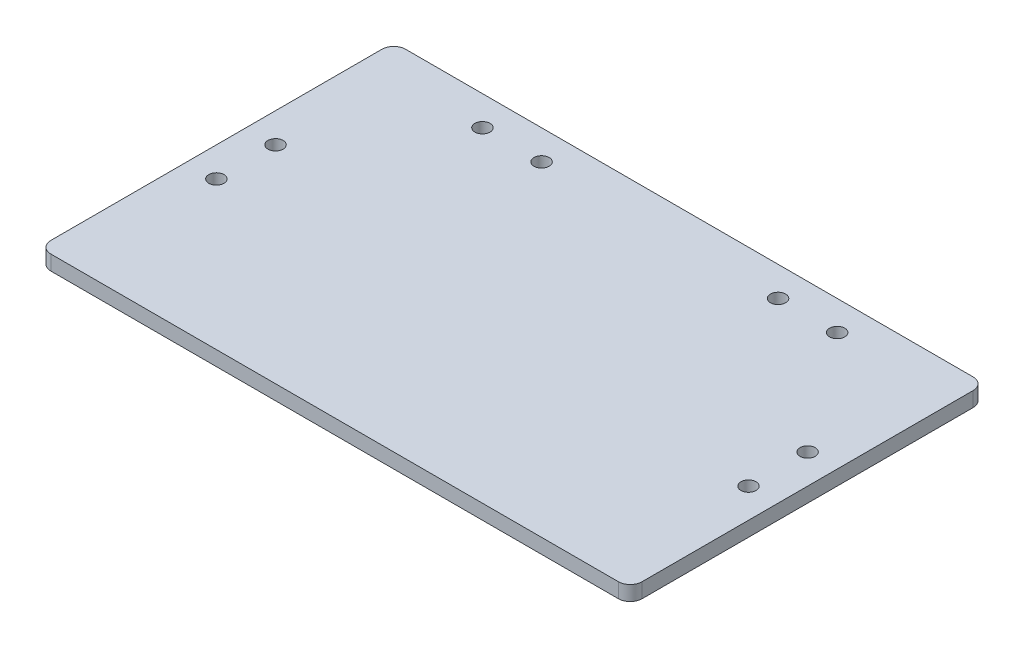
from build123d import *

# Parameters (mm, degrees)
SKETCH1_W           = 254
SKETCH1_H           = 152.4
BOSS_EXTRUDE1_DEPTH = 6.35
SKETCH3_R           = 3.2639
CUT_EXTRUDE2_DEPTH  = 149.24224263
FILLET1_R           = 5.08


with BuildPart() as part:
    # Sketch1 → Boss-Extrude1 (new body)
    with BuildSketch(Plane(origin=(0, 0, 0), x_dir=(1, 0, 0), z_dir=(0, 1, 0))):
        Rectangle(SKETCH1_W, SKETCH1_H)
    extrude(amount=BOSS_EXTRUDE1_DEPTH)

    # Sketch3 → Cut-Extrude2 (cut, through all)
    with BuildSketch(Plane(origin=(0, 6.35, 0), x_dir=(1, 0, 0), z_dir=(0, 1, 0))):
        with Locations(Location((-114.3, 12.7, 0), (0, 0, 270))):
            Circle(SKETCH3_R)
        with Locations(Location((-114.3, -12.7, 0), (0, 0, 270))):
            Circle(SKETCH3_R)
        with Locations(Location((-76.2, 63.5, 0), (0, 0, 270))):
            Circle(SKETCH3_R)
        with Locations(Location((-50.8, 63.5, 0), (0, 0, 270))):
            Circle(SKETCH3_R)
        with Locations(Location((50.8, 63.5, 0), (0, 0, 90))):
            Circle(SKETCH3_R)
        with Locations(Location((76.2, 63.5, 0), (0, 0, 90))):
            Circle(SKETCH3_R)
        with Locations(Location((114.3, -12.7, 0), (0, 0, 90))):
            Circle(SKETCH3_R)
        with Locations(Location((114.3, 12.7, 0), (0, 0, 90))):
            Circle(SKETCH3_R)
    extrude(amount=-CUT_EXTRUDE2_DEPTH, mode=Mode.SUBTRACT)

    # Fillet1
    fillet1_edges = [part.edges().sort_by_distance(p)[0] for p in [
        (127, 3.175, 76.2),
        (-127, 3.175, 76.2),
        (-127, 3.175, -76.2),
        (127, 3.175, -76.2),
    ]]
    fillet(fillet1_edges, radius=FILLET1_R)


solid = part.part
